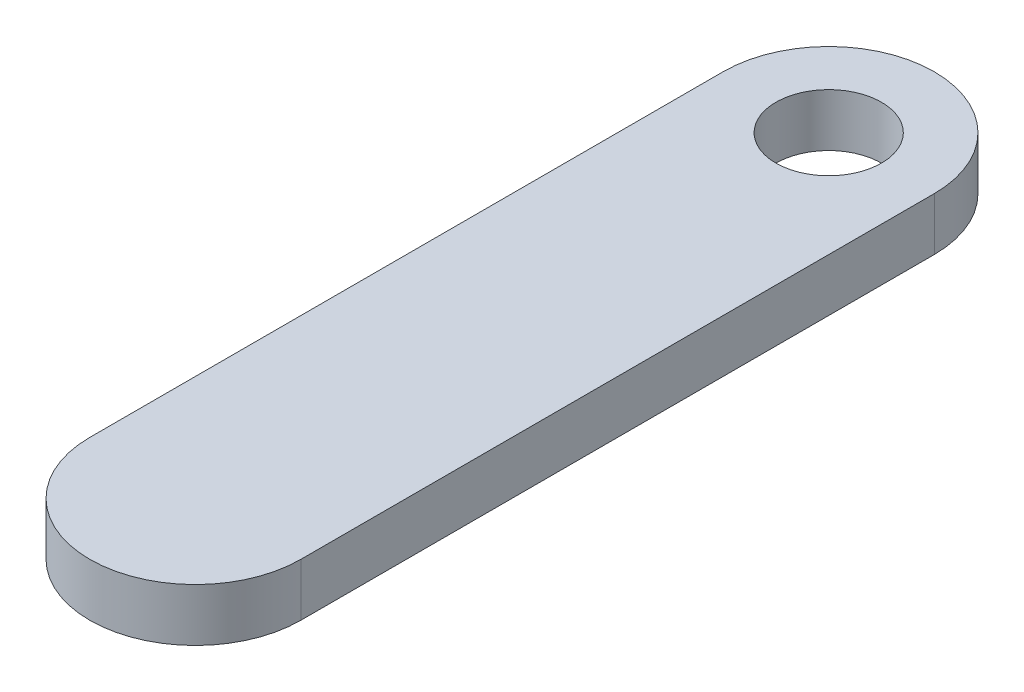
from build123d import *

# Parameters (mm, degrees)
SKETCH1_R           = 6.35
BOSS_EXTRUDE1_DEPTH = 6.35


with BuildPart() as part:
    # Sketch1 → Boss-Extrude1 (new body)
    with BuildSketch(Plane(origin=(0, 0, 0), x_dir=(1, 0, 0), z_dir=(0, 1, 0))):
        with BuildLine():
            Line((12.7, 0), (12.7, -76.2))
            ThreePointArc((12.7, -76.2), (0, -88.9), (-12.7, -76.2))
            Line((-12.7, -76.2), (-12.7, 0))
            ThreePointArc((-12.7, 0), (0, 12.7), (12.7, 0))
        make_face()
        with Locations(Location((0, 0, 0), (0, 0, 270))):
            Circle(SKETCH1_R, mode=Mode.SUBTRACT)
    extrude(amount=BOSS_EXTRUDE1_DEPTH)


solid = part.part
